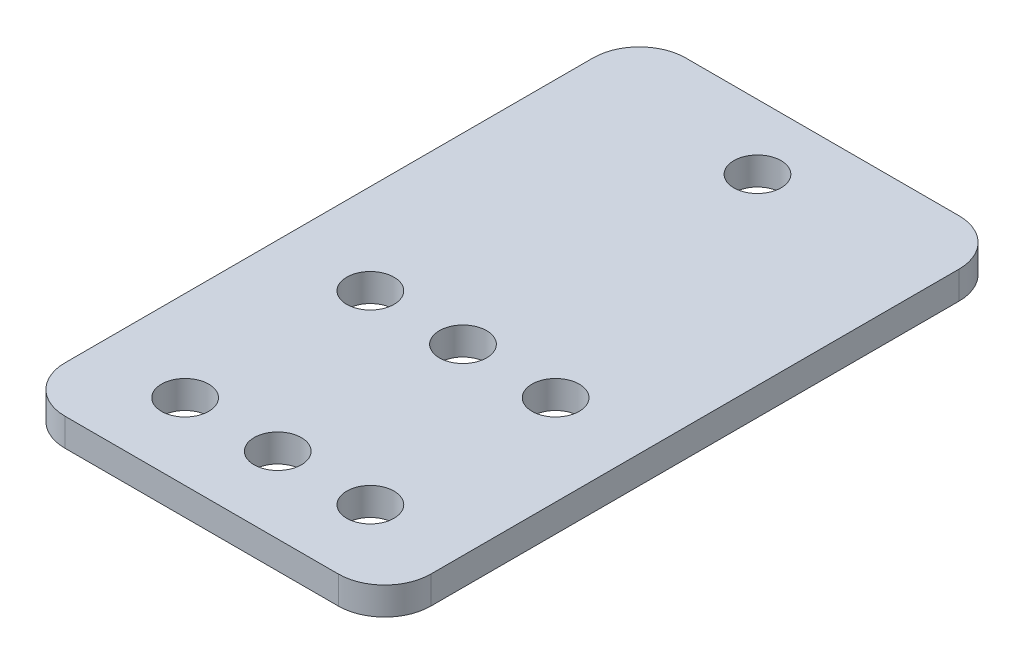
from build123d import *

# Parameters (mm, degrees)
SKETCH1_R           = 2.55
BOSS_EXTRUDE1_DEPTH = 3


with BuildPart() as part:
    # Sketch1 → Boss-Extrude1 (new body)
    with BuildSketch(Plane(origin=(0, 0, 0), x_dir=(1, 0, 0), z_dir=(0, 1, 0))):
        with BuildLine():
            Line((14.75, -33.5), (-14.75, -33.5))
            ThreePointArc((-14.75, -33.5), (-18.285533906, -32.035533906), (-19.75, -28.5))
            Line((-19.75, -28.5), (-19.75, 28.5))
            ThreePointArc((-19.75, 28.5), (-18.285533906, 32.035533906), (-14.75, 33.5))
            Line((-14.75, 33.5), (14.75, 33.5))
            ThreePointArc((14.75, 33.5), (18.285533906, 32.035533906), (19.75, 28.5))
            Line((19.75, 28.5), (19.75, -28.5))
            ThreePointArc((19.75, -28.5), (18.285533906, -32.035533906), (14.75, -33.5))
        make_face()
        with Locations(Location((0, 26.5, 0), (0, 0, 270))):
            Circle(SKETCH1_R, mode=Mode.SUBTRACT)
        with Locations(Location((10, -25.29, 0), (0, 0, 270))):
            Circle(SKETCH1_R, mode=Mode.SUBTRACT)
        with Locations(Location((10, -5.29, 0), (0, 0, 270))):
            Circle(SKETCH1_R, mode=Mode.SUBTRACT)
        with Locations(Location((0, -25.29, 0), (0, 0, 270))):
            Circle(SKETCH1_R, mode=Mode.SUBTRACT)
        with Locations(Location((0, -5.29, 0), (0, 0, 270))):
            Circle(SKETCH1_R, mode=Mode.SUBTRACT)
        with Locations(Location((-10, -25.29, 0), (0, 0, 270))):
            Circle(SKETCH1_R, mode=Mode.SUBTRACT)
        with Locations(Location((-10, -5.29, 0), (0, 0, 270))):
            Circle(SKETCH1_R, mode=Mode.SUBTRACT)
    extrude(amount=BOSS_EXTRUDE1_DEPTH)


solid = part.part
